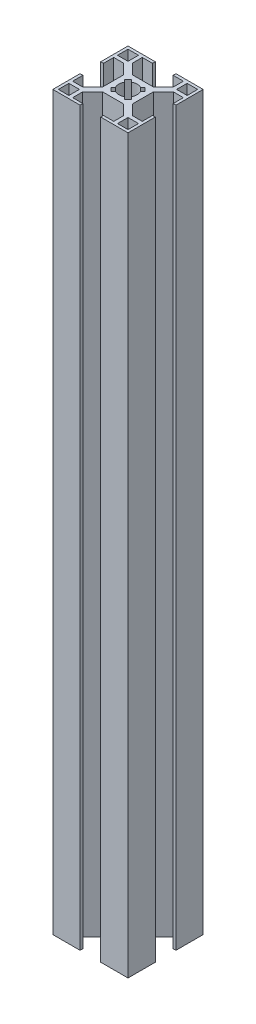
from build123d import *

# Parameters (mm, degrees)
CROQUIS2_W              = 4.2
CROQUIS2_H              = 4.2
SALIENTE_EXTRUIR1_DEPTH = 292.1


with BuildPart() as part:
    # Croquis2 → Saliente-Extruir1 (new body)
    with BuildSketch(Plane(origin=(0, 0, 0), x_dir=(1, 0, 0), z_dir=(0, 1, 0))):
        Polygon((-37.373217156, 24.271112291), (-26.498217156, 24.271112291), (-26.498217156, 23.171112291), (-30.573217156, 23.171112291), (-30.573217156, 19.168168566), (-26.586160881, 15.181112291), (-18.160273431, 15.181112291), (-14.173217156, 19.168168566), (-14.173217156, 23.171112291), (-18.248217156, 23.171112291), (-18.248217156, 24.271112291), (-7.373217156, 24.271112291), (-7.373217156, 13.396112291), (-8.473217156, 13.396112291), (-8.473217156, 17.471112291), (-12.476160881, 17.471112291), (-16.463217156, 13.484056016), (-16.463217156, 5.058168566), (-12.476160881, 1.071112291), (-8.473217156, 1.071112291), (-8.473217156, 5.146112291), (-7.373217156, 5.146112291), (-7.373217156, -5.728887709), (-18.248217156, -5.728887709), (-18.248217156, -4.628887709), (-14.173217156, -4.628887709), (-14.173217156, -0.625943984), (-18.160273431, 3.361112291), (-26.586160881, 3.361112291), (-30.573217156, -0.625943984), (-30.573217156, -4.628887709), (-26.498217156, -4.628887709), (-26.498217156, -5.728887709), (-37.373217156, -5.728887709), (-37.373217156, 5.146112291), (-36.273217156, 5.146112291), (-36.273217156, 1.071112291), (-32.270273431, 1.071112291), (-28.283217156, 5.058168566), (-28.283217156, 13.484056016), (-32.270273431, 17.471112291), (-36.273217156, 17.471112291), (-36.273217156, 13.396112291), (-37.373217156, 13.396112291), align=None)
        with Locations((-10.573217156, 21.071112291)):
            Rectangle(CROQUIS2_W, CROQUIS2_H, mode=Mode.SUBTRACT)
        with Locations((-34.173217156, -2.528887709)):
            Rectangle(CROQUIS2_W, CROQUIS2_H, mode=Mode.SUBTRACT)
        with Locations((-34.173217156, 21.071112291)):
            Rectangle(CROQUIS2_W, CROQUIS2_H, mode=Mode.SUBTRACT)
        with Locations((-10.573217156, -2.528887709)):
            Rectangle(CROQUIS2_W, CROQUIS2_H, mode=Mode.SUBTRACT)
        with BuildLine():
            Line((-19.165547938, 11.064567946), (-18.248217156, 11.981898728))
            Line((-18.248217156, 11.981898728), (-19.662430718, 13.396112291))
            Line((-19.662430718, 13.396112291), (-20.5797615, 12.478781509))
            ThreePointArc((-20.5797615, 12.478781509), (-22.373217156, 12.946112291), (-24.166672811, 12.478781509))
            Line((-24.166672811, 12.478781509), (-25.084003593, 13.396112291))
            Line((-25.084003593, 13.396112291), (-26.498217156, 11.981898728))
            Line((-26.498217156, 11.981898728), (-25.580886374, 11.064567946))
            ThreePointArc((-25.580886374, 11.064567946), (-26.048217156, 9.271112291), (-25.580886374, 7.477656635))
            Line((-25.580886374, 7.477656635), (-26.498217156, 6.560325853))
            Line((-26.498217156, 6.560325853), (-25.084003593, 5.146112291))
            Line((-25.084003593, 5.146112291), (-24.166672811, 6.063443073))
            ThreePointArc((-24.166672811, 6.063443073), (-22.373217156, 5.596112291), (-20.5797615, 6.063443073))
            Line((-20.5797615, 6.063443073), (-19.662430718, 5.146112291))
            Line((-19.662430718, 5.146112291), (-18.248217156, 6.560325853))
            Line((-18.248217156, 6.560325853), (-19.165547938, 7.477656635))
            ThreePointArc((-19.165547938, 7.477656635), (-18.698217156, 9.271112291), (-19.165547938, 11.064567946))
        make_face(mode=Mode.SUBTRACT)
    extrude(amount=SALIENTE_EXTRUIR1_DEPTH)


solid = part.part
